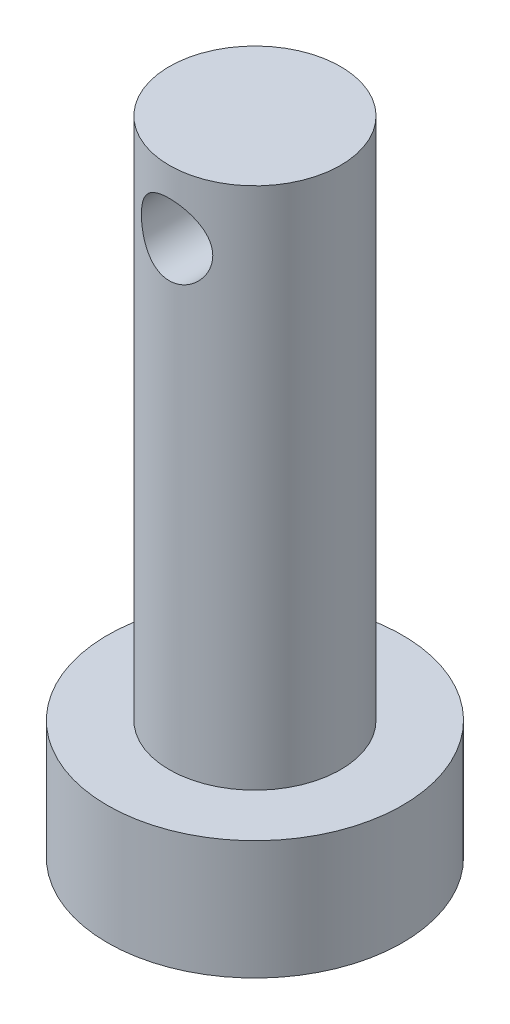
from build123d import *

# Parameters (mm, degrees)
SKETCH2_R               = 3.1
BOSS_EXTRUDE1_DEPTH     = 2.5
SKETCH3_R               = 1.8
BOSS_EXTRUDE3_DEPTH     = 11
CUT_EXTRUDE1_DEPTH      = 15.194012822
CUT_EXTRUDE1_DEPTH_BACK = 15.194012822
SKETCH4_R               = 0.75


with BuildPart() as part:
    # Sketch2 → Boss-Extrude1 (new body)
    with BuildSketch(Plane(origin=(0, 0, 0), x_dir=(1, 0, 0), z_dir=(0, 1, 0))):
        with Locations(Location((0, 0, 0), (0, 0, 270))):
            Circle(SKETCH2_R)
    extrude(amount=BOSS_EXTRUDE1_DEPTH)

    # Sketch3 → Boss-Extrude3 (add)
    with BuildSketch(Plane(origin=(0, 2.5, 0), x_dir=(1, 0, 0), z_dir=(0, 1, 0))):
        with Locations(Location((0, 0, 0), (0, 0, 270))):
            Circle(SKETCH3_R)
    extrude(amount=BOSS_EXTRUDE3_DEPTH)

    # Sketch4 → Cut-Extrude1 (cut, two sides: drawn at the far end of the back side and taken through both)
    with BuildSketch(Plane.XY.offset(-CUT_EXTRUDE1_DEPTH_BACK)):
        with Locations(Location((0, 12.15, 0), (0, 0, 90))):
            Circle(SKETCH4_R)
    extrude(amount=CUT_EXTRUDE1_DEPTH + CUT_EXTRUDE1_DEPTH_BACK, mode=Mode.SUBTRACT)


solid = part.part
